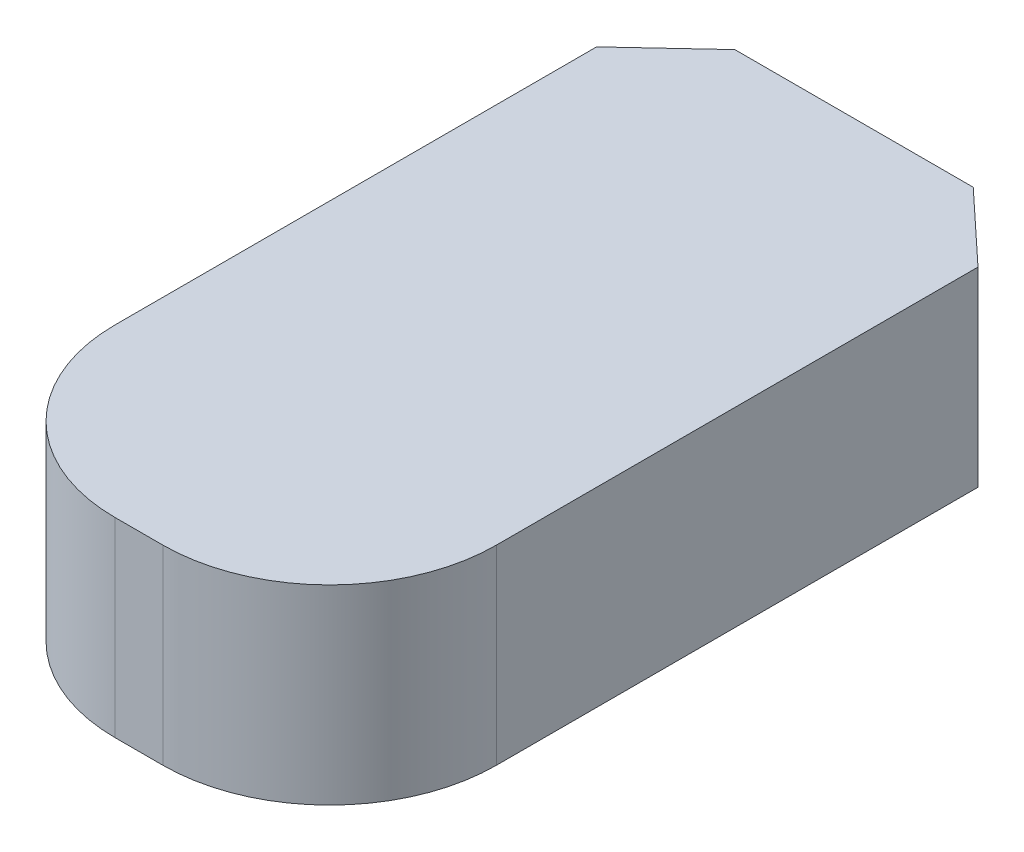
from build123d import *

# Parameters (mm, degrees)
BOSS_EXTRUDE2_DEPTH = 20


with BuildPart() as part:
    # Sketch1 → Boss-Extrude2 (new body)
    with BuildSketch(Plane(origin=(0, 0, 0), x_dir=(1, 0, 0), z_dir=(0, 1, 0))):
        with BuildLine():
            Line((-12.5, 37.5), (12.5, 37.5))
            Line((12.5, 37.5), (20, 30.5))
            Line((20, 30.5), (20, -20))
            ThreePointArc((20, -20), (14.874368671, -32.374368671), (2.5, -37.5))
            Line((2.5, -37.5), (-2.5, -37.5))
            ThreePointArc((-2.5, -37.5), (-14.874368671, -32.374368671), (-20, -20))
            Line((-20, -20), (-20, 30.5))
            Line((-20, 30.5), (-12.5, 37.5))
        make_face()
    extrude(amount=BOSS_EXTRUDE2_DEPTH)


solid = part.part
